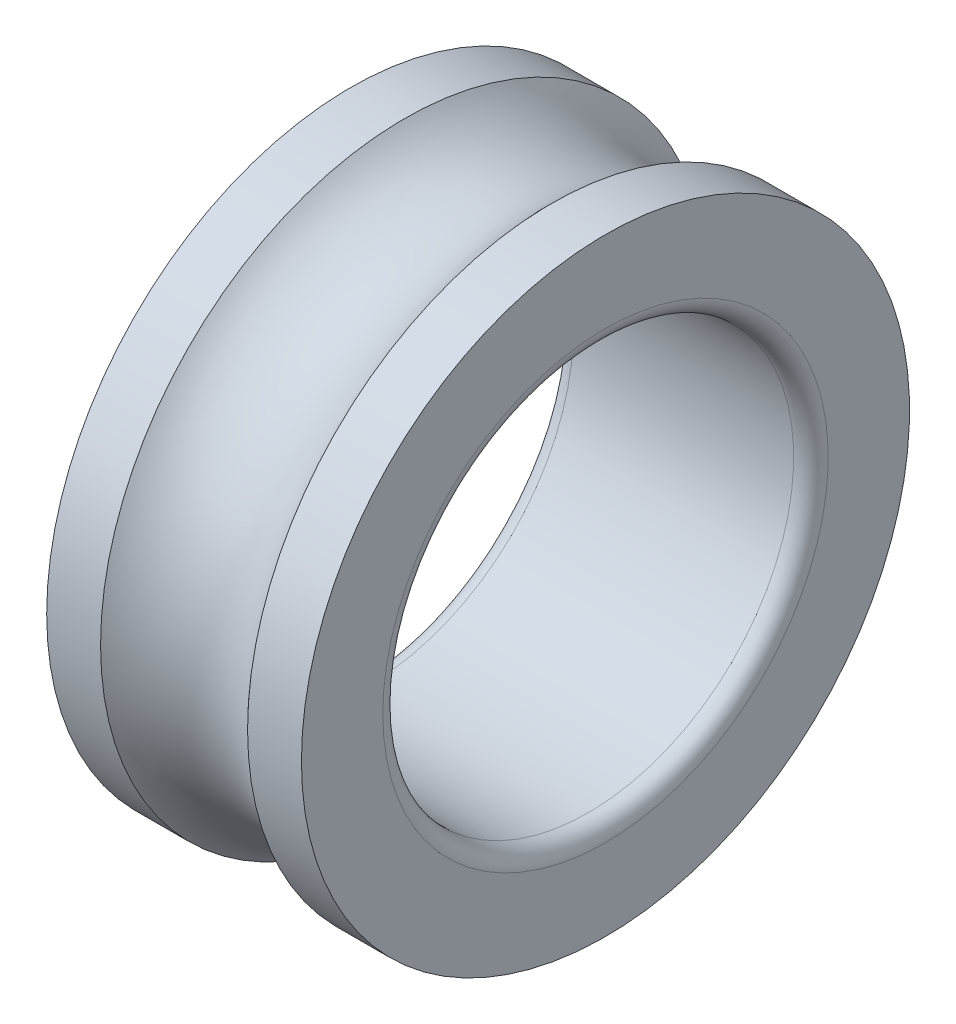
from build123d import *


with BuildPart() as part:
    # Sketch1 → Revolve1 (revolve)
    with BuildSketch(Plane.XY, mode=Mode.PRIVATE) as revolve1_sk:
        with BuildLine():
            Line((13.4, 25), (-13.4, 25))
            ThreePointArc((-13.4, 25), (-14.88492424, 25.61507576), (-15.5, 27.1))
            Line((-15.5, 27.1), (-15.5, 37))
            Line((-15.5, 37), (-8.94427191, 37))
            ThreePointArc((-8.94427191, 37), (0, 33), (8.94427191, 37))
            Line((8.94427191, 37), (15.5, 37))
            Line((15.5, 37), (15.5, 27.1))
            ThreePointArc((15.5, 27.1), (14.88492424, 25.61507576), (13.4, 25))
        make_face()
    revolve(revolve1_sk.sketch.rotate(Axis((-20.959119497, 0, 0), (1, 0, 0)), 90), axis=Axis((-20.959119497, 0, 0), (1, 0, 0)))


solid = part.part
